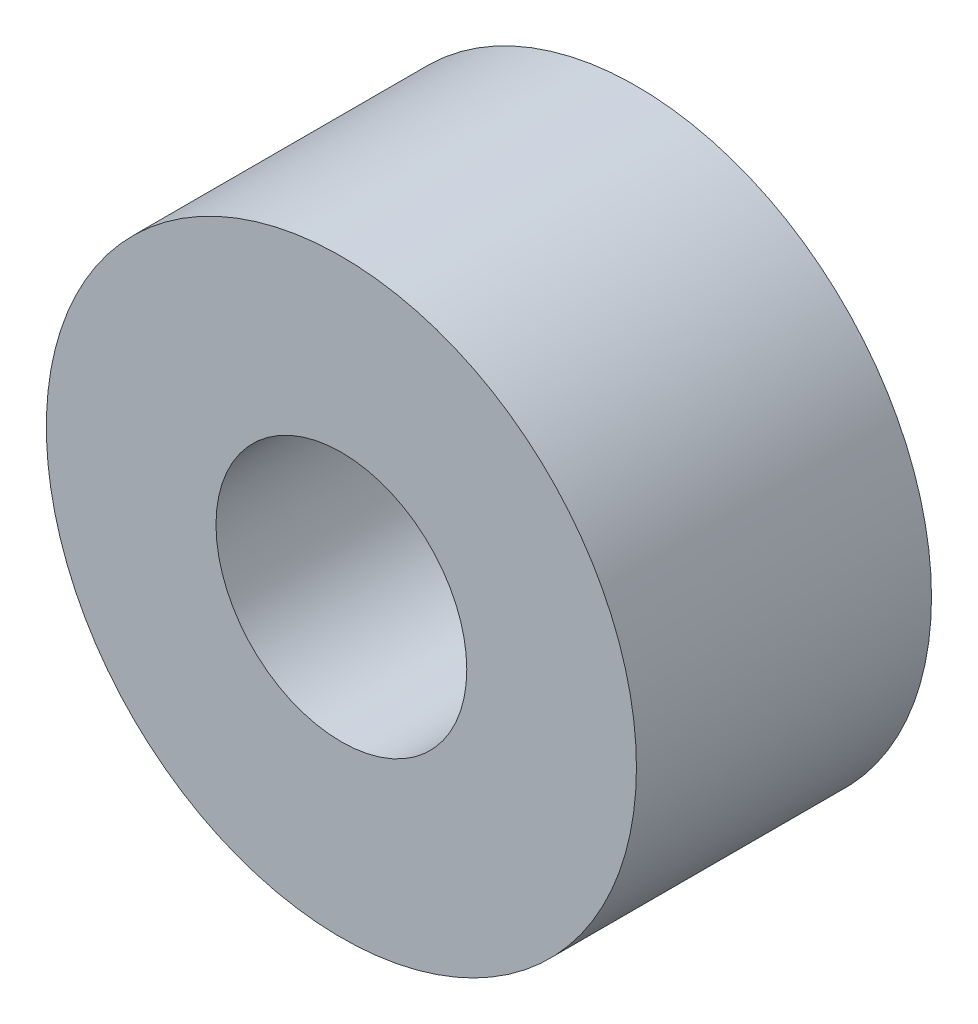
from build123d import *

# Parameters (mm, degrees)
SKETCH1_R           = 4
SKETCH1_R_2         = 1.7
BOSS_EXTRUDE1_DEPTH = 4


with BuildPart() as part:
    # Sketch1 → Boss-Extrude1 (new body)
    with BuildSketch(Plane.XY):
        with Locations((-19.5, 52.8)):
            Circle(SKETCH1_R)
        with Locations((-19.5, 52.8)):
            Circle(SKETCH1_R_2, mode=Mode.SUBTRACT)
    extrude(amount=BOSS_EXTRUDE1_DEPTH)


solid = part.part
